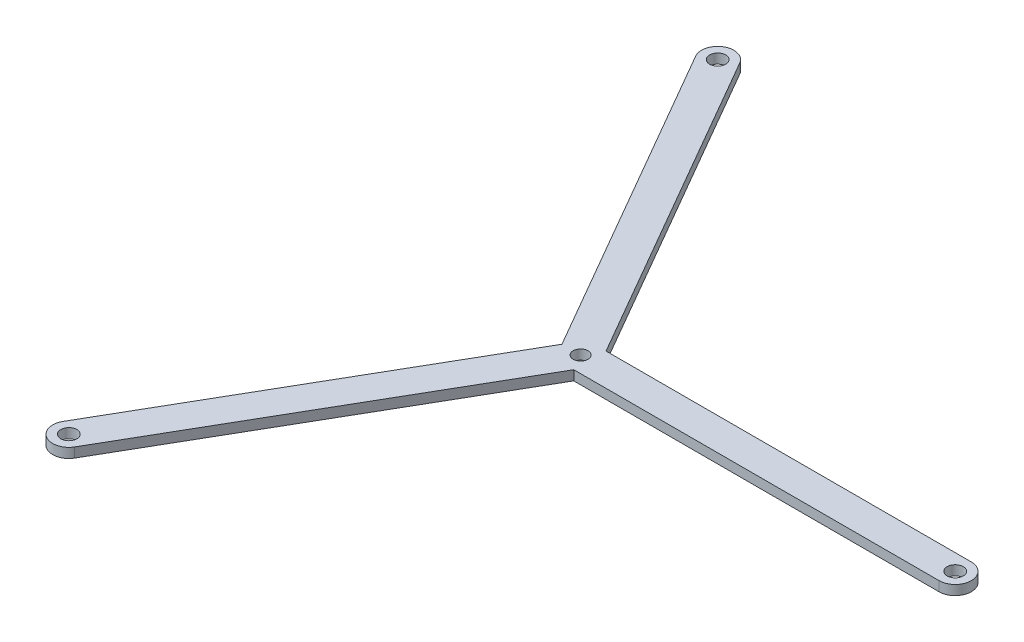
from build123d import *

# Parameters (mm, degrees)
SKETCH8_R           = 2.5
SKETCH8_R_2         = 2.3
BOSS_EXTRUDE5_DEPTH = 3


with BuildPart() as part:
    # Sketch8 → Boss-Extrude5 (new body)
    # profile 1 of 7: a face of its own
    with BuildSketch(Plane(origin=(0, 0, 0), x_dir=(1, 0, 0), z_dir=(0, 1, 0))):
        with BuildLine():
            ThreePointArc((-4.330127019, 2.5), (-2.5, 4.330127019), (0, 5))
            Line((0, 5), (2.886751346, 5))
            Line((2.886751346, 5), (-53.669872981, 102.958946839))
            ThreePointArc((-53.669872981, 102.958946839), (-60.5, 104.789073858), (-62.330127019, 97.958946839))
            Line((-62.330127019, 97.958946839), (-5.773502692, 0))
            Line((-5.773502692, 0), (-4.330127019, 2.5))
        make_face()
        with Locations(Location((-58, 100.458946839, 0), (0, 0, 270))):
            Circle(SKETCH8_R, mode=Mode.SUBTRACT)
    # profile 2 of 7: a face of its own
    with BuildSketch(Plane(origin=(0, 0, 0), x_dir=(1, 0, 0), z_dir=(0, 1, 0))):
        with BuildLine():
            Line((116, 5), (2.886751346, 5))
            Line((2.886751346, 5), (4.330127019, 2.5))
            ThreePointArc((4.330127019, 2.5), (5, 0), (4.330127019, -2.5))
            Line((4.330127019, -2.5), (2.886751346, -5))
            Line((2.886751346, -5), (116, -5))
            ThreePointArc((116, -5), (121, 0), (116, 5))
        make_face()
        with Locations(Location((116, 0, 0), (0, 0, 270))):
            Circle(SKETCH8_R, mode=Mode.SUBTRACT)
    # profile 3 of 7: a face of its own
    with BuildSketch(Plane(origin=(0, 0, 0), x_dir=(1, 0, 0), z_dir=(0, 1, 0))):
        with BuildLine():
            Line((-4.330127019, -2.5), (-5.773502692, 0))
            Line((-5.773502692, 0), (-62.330127019, -97.958946839))
            ThreePointArc((-62.330127019, -97.958946839), (-60.5, -104.789073858), (-53.669872981, -102.958946839))
            Line((-53.669872981, -102.958946839), (2.886751346, -5))
            Line((2.886751346, -5), (0, -5))
            ThreePointArc((0, -5), (-2.5, -4.330127019), (-4.330127019, -2.5))
        make_face()
        with Locations(Location((-58, -100.458946839, 0), (0, 0, 270))):
            Circle(SKETCH8_R, mode=Mode.SUBTRACT)
    # profile 4 of 7: a face of its own
    with BuildSketch(Plane(origin=(0, 0, 0), x_dir=(1, 0, 0), z_dir=(0, 1, 0))):
        with BuildLine():
            ThreePointArc((4.330127019, 2.5), (2.5, 4.330127019), (0, 5))
            ThreePointArc((0, 5), (-2.5, 4.330127019), (-4.330127019, 2.5))
            ThreePointArc((-4.330127019, 2.5), (-5, 0), (-4.330127019, -2.5))
            ThreePointArc((-4.330127019, -2.5), (-2.5, -4.330127019), (0, -5))
            ThreePointArc((0, -5), (2.5, -4.330127019), (4.330127019, -2.5))
            ThreePointArc((4.330127019, -2.5), (5, 0), (4.330127019, 2.5))
        make_face()
        with Locations(Location((0, 0, 0), (0, 0, 270))):
            Circle(SKETCH8_R_2, mode=Mode.SUBTRACT)
    # profile 5 of 7: a face of its own
    with BuildSketch(Plane(origin=(0, 0, 0), x_dir=(1, 0, 0), z_dir=(0, 1, 0))):
        with BuildLine():
            Line((2.886751346, 5), (0, 5))
            ThreePointArc((0, 5), (2.5, 4.330127019), (4.330127019, 2.5))
            Line((4.330127019, 2.5), (2.886751346, 5))
        make_face()
    # profile 6 of 7: a face of its own
    with BuildSketch(Plane(origin=(0, 0, 0), x_dir=(1, 0, 0), z_dir=(0, 1, 0))):
        with BuildLine():
            ThreePointArc((-4.330127019, -2.5), (-5, 0), (-4.330127019, 2.5))
            Line((-4.330127019, 2.5), (-5.773502692, 0))
            Line((-5.773502692, 0), (-4.330127019, -2.5))
        make_face()
    # profile 7 of 7: a face of its own
    with BuildSketch(Plane(origin=(0, 0, 0), x_dir=(1, 0, 0), z_dir=(0, 1, 0))):
        with BuildLine():
            Line((2.886751346, -5), (4.330127019, -2.5))
            ThreePointArc((4.330127019, -2.5), (2.5, -4.330127019), (0, -5))
            Line((0, -5), (2.886751346, -5))
        make_face()
    extrude(amount=BOSS_EXTRUDE5_DEPTH)


solid = part.part
